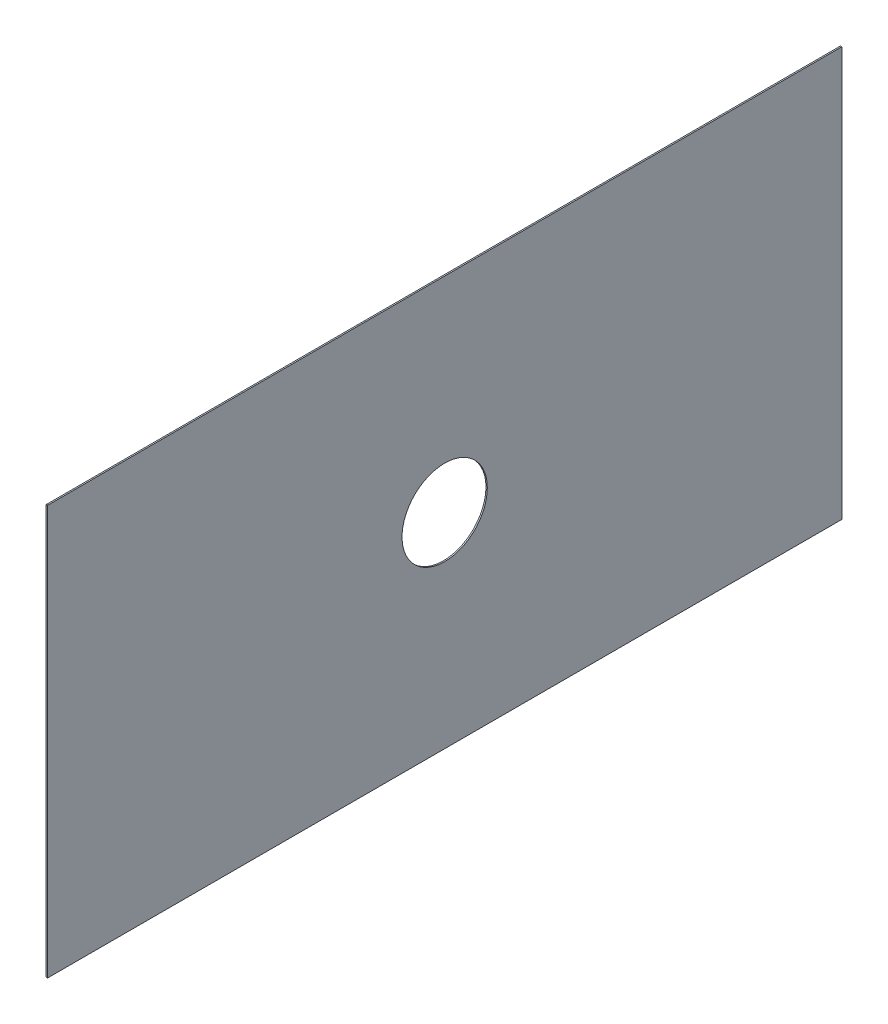
from build123d import *

# Parameters (mm, degrees)
CROQUIS1_W     = 1164
CROQUIS1_H     = 600
EXTRUIR1_DEPTH = 2
CROQUIS2_R     = 62.5
EXTRUIR2_DEPTH = 2


with BuildPart() as part:
    # Croquis1 → Extruir1 (new body)
    with BuildSketch(Plane(origin=(0, 0, 0), x_dir=(0, 0, -1), z_dir=(1, 0, 0))):
        Rectangle(CROQUIS1_W, CROQUIS1_H)
    extrude(amount=EXTRUIR1_DEPTH)

    # Croquis2 → Extruir2 (cut)
    with BuildSketch(Plane(origin=(2, 0, 0), x_dir=(0, 0, -1), z_dir=(1, 0, 0))):
        Circle(CROQUIS2_R)
    extrude(amount=-EXTRUIR2_DEPTH, mode=Mode.SUBTRACT)


solid = part.part
